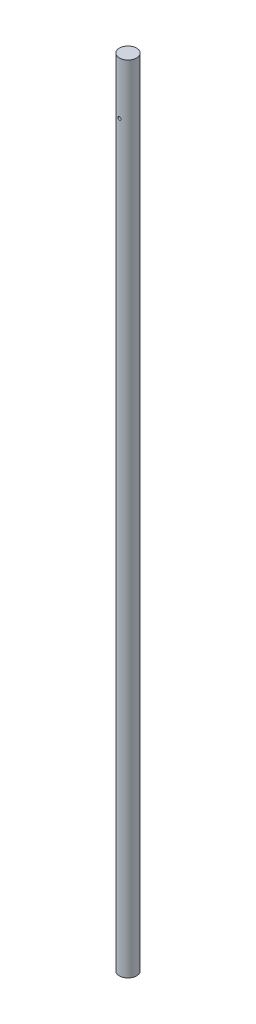
from build123d import *

# Parameters (mm, degrees)
SKETCH1_R                       = 16.25
BOSS_EXTRUDE1_DEPTH             = 1500
F_6_0MM_CLEARANCE_DOWEL_HOLE1_D = 6


with BuildPart() as part:
    # Sketch1 → Boss-Extrude1 (new body)
    with BuildSketch(Plane(origin=(0, 0, 0), x_dir=(1, 0, 0), z_dir=(0, 1, 0))):
        with Locations(Location((0, 0, 0), (0, 0, 270))):
            Circle(SKETCH1_R)
    extrude(amount=BOSS_EXTRUDE1_DEPTH)

    # Ø6.0mm Clearance Dowel Hole1 (through all)
    with Locations(Plane(origin=(0, 1401.329145641, 16.25), x_dir=(1, 0, 0), z_dir=(0, 0, 1))):
        with Locations((0, 0)):
            Hole(F_6_0MM_CLEARANCE_DOWEL_HOLE1_D / 2)


solid = part.part
